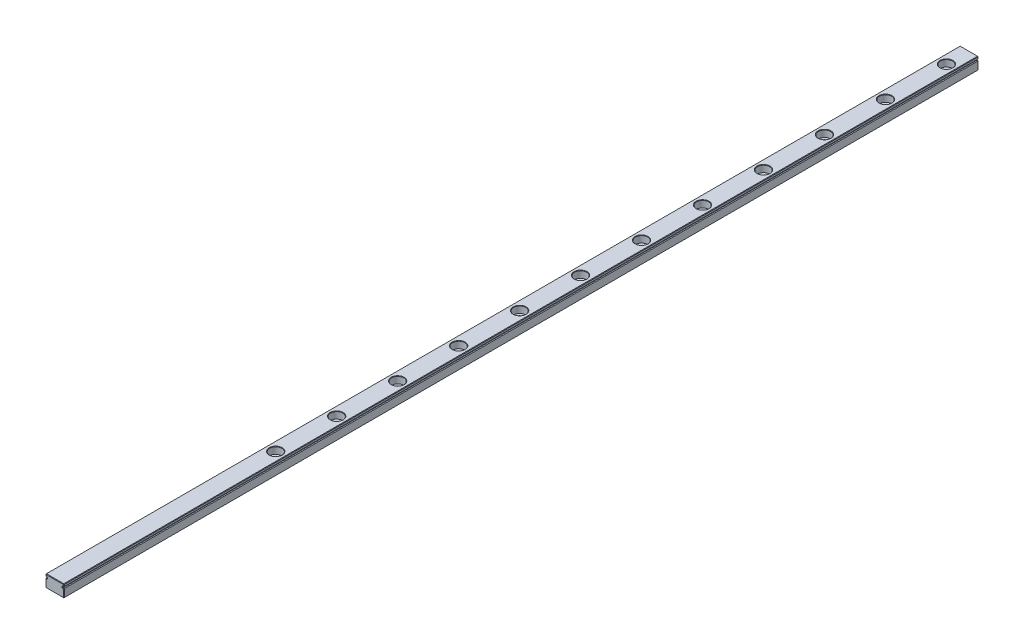
from build123d import *

# Parameters (mm, degrees)
BOSS_EXTRUDE1_DEPTH = 600
CHAMFER1_SIZE       = 0.3
LPATTERN1_COUNT     = 12
LPATTERN1_PITCH     = 40


with BuildPart() as part:
    # Sketch1 → Boss-Extrude1 (new body)
    with BuildSketch(Plane.XY):
        with BuildLine():
            Line((0, 8), (12, 8))
            Line((12, 8), (12, 6.75))
            Line((12, 6.75), (12, 6.559016994))
            ThreePointArc((12, 6.559016994), (11.706107374, 6.475528258), (11.5, 6.25))
            Line((11.5, 6.25), (11, 6.25))
            Line((11, 6.25), (11, 5.75))
            Line((11, 5.75), (11.5, 5.75))
            ThreePointArc((11.5, 5.75), (11.706107374, 5.524471742), (12, 5.440983006))
            Line((12, 5.440983006), (12, 5.25))
            Line((12, 5.25), (12, 0))
            Line((12, 0), (0, 0))
            Line((0, 0), (0, 5.25))
            Line((0, 5.25), (0, 5.440983006))
            ThreePointArc((0, 5.440983006), (0.293892626, 5.524471742), (0.5, 5.75))
            Line((0.5, 5.75), (1, 5.75))
            Line((1, 5.75), (1, 6.25))
            Line((1, 6.25), (0.5, 6.25))
            ThreePointArc((0.5, 6.25), (0.293892626, 6.475528258), (0, 6.559016994))
            Line((0, 6.559016994), (0, 6.75))
            Line((0, 6.75), (0, 8))
        make_face()
    extrude(amount=BOSS_EXTRUDE1_DEPTH)

    # Chamfer1
    chamfer1_edges = [part.edges().sort_by_distance(p)[0] for p in [
        (12, 2.720491503, 600),
        (11.706107374, 5.524471742, 600),
        (0, 2.720491503, 0),
        (0.293892626, 5.524471742, 0),
        (0.75, 5.75, 0),
        (1, 6, 0),
        (0.75, 6.25, 0),
        (11.25, 5.75, 600),
        (0.293892626, 6.475528258, 0),
        (0, 7.279508497, 0),
        (6, 8, 0),
        (12, 7.279508497, 0),
        (11.706107374, 6.475528258, 0),
        (11, 6, 600),
        (11.25, 6.25, 0),
        (11, 6, 0),
        (11.25, 5.75, 0),
        (11.706107374, 5.524471742, 0),
        (12, 2.720491503, 0),
        (6, 0, 0),
        (11.25, 6.25, 600),
        (11.706107374, 6.475528258, 600),
        (12, 7.279508497, 600),
        (0, 8, 300),
        (12, 8, 300),
        (12, 0, 300),
        (0, 0, 300),
        (6, 8, 600),
        (0, 2.720491503, 600),
        (0, 7.279508497, 600),
        (0.293892626, 6.475528258, 600),
        (0.75, 6.25, 600),
        (1, 6, 600),
        (0.75, 5.75, 600),
        (0.293892626, 5.524471742, 600),
        (6, 0, 600),
    ]]
    chamfer(chamfer1_edges, length=CHAMFER1_SIZE)

    # Sketch3 → CBORE for M5 Hex Head Bolt1 (revolve, cut)
    with BuildSketch(Plane(origin=(6, 8, 15), x_dir=(0, 0, 1), z_dir=(1, 0, 0))):
        Polygon((0, 0), (0, 8), (2.5, 8), (2.25, 7.75), (2.25, 4.5), (4, 4.5), (4, 0.25), (4.25, 0), align=None)
    cbore_for_m5_hex_head_bolt1 = revolve(axis=Axis((6, 14.35, 15), (0, -1, 0)), mode=Mode.SUBTRACT)

    # LPattern1: CBORE for M5 Hex Head Bolt1 ×12
    with Locations(*[(0, 0, i * LPATTERN1_PITCH) for i in range(1, LPATTERN1_COUNT)]):
        add(cbore_for_m5_hex_head_bolt1, mode=Mode.SUBTRACT)


solid = part.part
